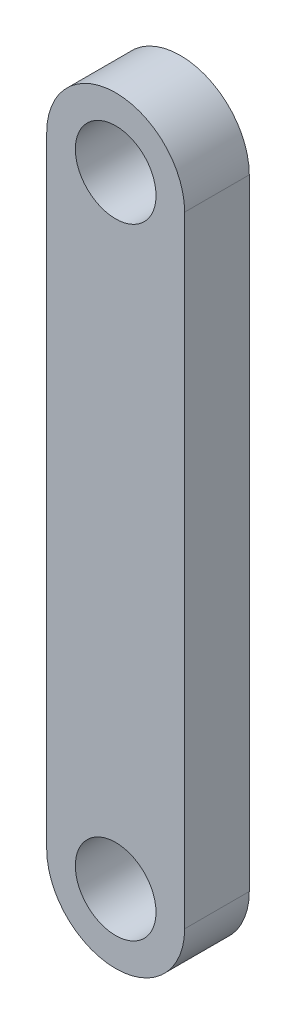
from build123d import *

# Parameters (mm, degrees)
SKETCH1_R           = 1.872
BOSS_EXTRUDE1_DEPTH = 3


with BuildPart() as part:
    # Sketch1 → Boss-Extrude1 (new body)
    with BuildSketch(Plane.XY):
        with BuildLine():
            Line((-3.2, 28.8), (-3.2, 0))
            ThreePointArc((-3.2, 0), (0, -3.2), (3.2, 0))
            Line((3.2, 0), (3.2, 28.8))
            ThreePointArc((3.2, 28.8), (0, 32), (-3.2, 28.8))
        make_face()
        Circle(SKETCH1_R, mode=Mode.SUBTRACT)
        with Locations((0, 28.8)):
            Circle(SKETCH1_R, mode=Mode.SUBTRACT)
    extrude(amount=BOSS_EXTRUDE1_DEPTH)


solid = part.part
